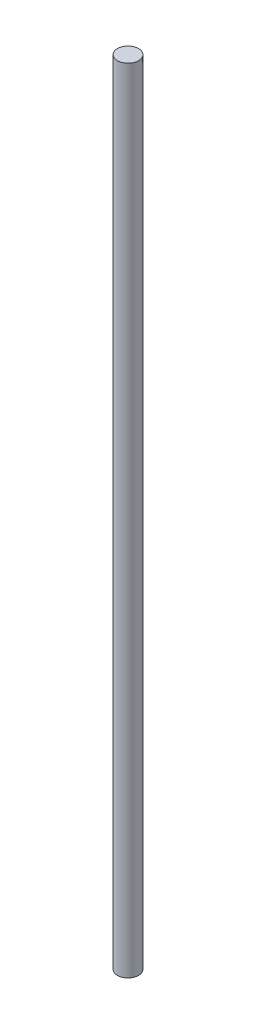
from build123d import *

# Parameters (mm, degrees)
SKETCH1_R           = 1.984375
BOSS_EXTRUDE1_DEPTH = 149.225


with BuildPart() as part:
    # Sketch1 → Boss-Extrude1 (new body)
    with BuildSketch(Plane(origin=(0, 0, 0), x_dir=(1, 0, 0), z_dir=(0, 1, 0))):
        with Locations(Location((-4.911077566, 2.455538783, 0), (0, 0, 270))):
            Circle(SKETCH1_R)
    extrude(amount=BOSS_EXTRUDE1_DEPTH)


solid = part.part
